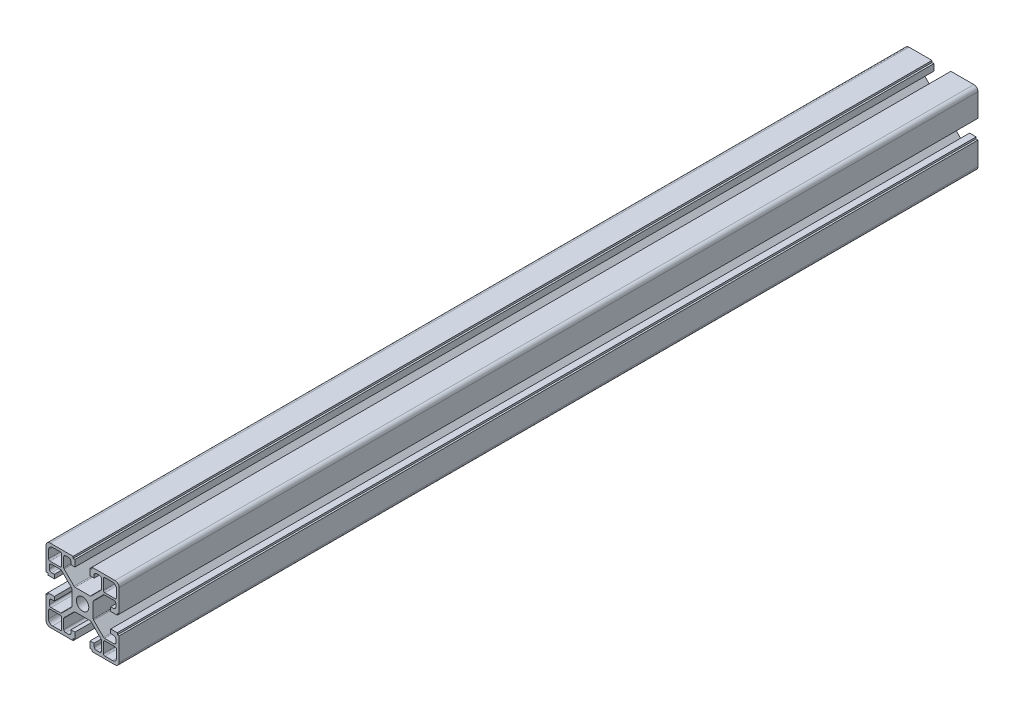
from build123d import *

# Parameters (mm, degrees)
SKETCH1_R           = 3.4
BOSS_EXTRUDE1_DEPTH = 713
SKETCH2_W           = 40
SKETCH2_H           = 243
CUT_EXTRUDE1_DEPTH  = 715.401147815


with BuildPart() as part:
    # Sketch1 → Boss-Extrude1 (new body)
    with BuildSketch(Plane.XY):
        with BuildLine():
            Line((20, 17.75), (20, 5.15))
            Line((20, 5.15), (19, 5.15))
            Line((19, 5.15), (19, 4.15))
            Line((19, 4.15), (15.4, 4.15))
            Line((15.4, 4.15), (15.4, 6.35))
            Line((15.4, 6.35), (16.95, 6.35))
            ThreePointArc((16.95, 6.35), (17.833883476, 6.716116524), (18.2, 7.6))
            Line((18.2, 7.6), (18.2, 9.3))
            ThreePointArc((18.2, 9.3), (17.907106781, 10.007106781), (17.2, 10.3))
            Line((17.2, 10.3), (12.03669957, 10.3))
            ThreePointArc((12.03669957, 10.3), (11.73040037, 10.239040459), (11.470780817, 10.065452001))
            Line((11.470780817, 10.065452001), (6.084081247, 4.674305984))
            ThreePointArc((6.084081247, 4.674305984), (5.910833239, 4.414848262), (5.85, 4.108853983))
            Line((5.85, 4.108853983), (5.85, -4.108853983))
            ThreePointArc((5.85, -4.108853983), (5.910833239, -4.414848262), (6.084081247, -4.674305984))
            Line((6.084081247, -4.674305984), (11.470780817, -10.065452001))
            ThreePointArc((11.470780817, -10.065452001), (11.73040037, -10.239040459), (12.03669957, -10.3))
            Line((12.03669957, -10.3), (17.2, -10.3))
            ThreePointArc((17.2, -10.3), (17.907106781, -10.007106781), (18.2, -9.3))
            Line((18.2, -9.3), (18.2, -7.6))
            ThreePointArc((18.2, -7.6), (17.833883476, -6.716116524), (16.95, -6.35))
            Line((16.95, -6.35), (15.4, -6.35))
            Line((15.4, -6.35), (15.4, -4.15))
            Line((15.4, -4.15), (19, -4.15))
            Line((19, -4.15), (19, -5.15))
            Line((19, -5.15), (20, -5.15))
            Line((20, -5.15), (20, -17.75))
            ThreePointArc((20, -17.75), (19.340990258, -19.340990258), (17.75, -20))
            Line((17.75, -20), (5.15, -20))
            Line((5.15, -20), (5.15, -19))
            Line((5.15, -19), (4.15, -19))
            Line((4.15, -19), (4.15, -15.4))
            Line((4.15, -15.4), (6.35, -15.4))
            Line((6.35, -15.4), (6.35, -16.95))
            ThreePointArc((6.35, -16.95), (6.716116524, -17.833883476), (7.6, -18.2))
            Line((7.6, -18.2), (9.3, -18.2))
            ThreePointArc((9.3, -18.2), (10.007106781, -17.907106781), (10.3, -17.2))
            Line((10.3, -17.2), (10.3, -12.054477022))
            ThreePointArc((10.3, -12.054477022), (10.239166761, -11.748482743), (10.065918753, -11.489025021))
            Line((10.065918753, -11.489025021), (4.665899173, -6.084547999))
            ThreePointArc((4.665899173, -6.084547999), (4.406279619, -5.910959541), (4.09998042, -5.85))
            Line((4.09998042, -5.85), (-4.09998042, -5.85))
            ThreePointArc((-4.09998042, -5.85), (-4.406279619, -5.910959541), (-4.665899173, -6.084547999))
            Line((-4.665899173, -6.084547999), (-10.065918753, -11.489025021))
            ThreePointArc((-10.065918753, -11.489025021), (-10.239166761, -11.748482743), (-10.3, -12.054477022))
            Line((-10.3, -12.054477022), (-10.3, -17.2))
            ThreePointArc((-10.3, -17.2), (-10.007106781, -17.907106781), (-9.3, -18.2))
            Line((-9.3, -18.2), (-7.6, -18.2))
            ThreePointArc((-7.6, -18.2), (-6.716116524, -17.833883476), (-6.35, -16.95))
            Line((-6.35, -16.95), (-6.35, -15.4))
            Line((-6.35, -15.4), (-4.15, -15.4))
            Line((-4.15, -15.4), (-4.15, -19))
            Line((-4.15, -19), (-5.15, -19))
            Line((-5.15, -19), (-5.15, -20))
            Line((-5.15, -20), (-17.75, -20))
            ThreePointArc((-17.75, -20), (-19.340990258, -19.340990258), (-20, -17.75))
            Line((-20, -17.75), (-20, -5.15))
            Line((-20, -5.15), (-19, -5.15))
            Line((-19, -5.15), (-19, -4.15))
            Line((-19, -4.15), (-15.4, -4.15))
            Line((-15.4, -4.15), (-15.4, -6.35))
            Line((-15.4, -6.35), (-16.95, -6.35))
            ThreePointArc((-16.95, -6.35), (-17.833883476, -6.716116524), (-18.2, -7.6))
            Line((-18.2, -7.6), (-18.2, -9.3))
            ThreePointArc((-18.2, -9.3), (-17.907106781, -10.007106781), (-17.2, -10.3))
            Line((-17.2, -10.3), (-12.03669957, -10.3))
            ThreePointArc((-12.03669957, -10.3), (-11.73040037, -10.239040459), (-11.470780817, -10.065452001))
            Line((-11.470780817, -10.065452001), (-6.084081247, -4.674305984))
            ThreePointArc((-6.084081247, -4.674305984), (-5.910833239, -4.414848262), (-5.85, -4.108853983))
            Line((-5.85, -4.108853983), (-5.85, 4.108853983))
            ThreePointArc((-5.85, 4.108853983), (-5.910833239, 4.414848262), (-6.084081247, 4.674305984))
            Line((-6.084081247, 4.674305984), (-11.470780817, 10.065452001))
            ThreePointArc((-11.470780817, 10.065452001), (-11.73040037, 10.239040459), (-12.03669957, 10.3))
            Line((-12.03669957, 10.3), (-17.2, 10.3))
            ThreePointArc((-17.2, 10.3), (-17.907106781, 10.007106781), (-18.2, 9.3))
            Line((-18.2, 9.3), (-18.2, 7.6))
            ThreePointArc((-18.2, 7.6), (-17.833883476, 6.716116524), (-16.95, 6.35))
            Line((-16.95, 6.35), (-15.4, 6.35))
            Line((-15.4, 6.35), (-15.4, 4.15))
            Line((-15.4, 4.15), (-19, 4.15))
            Line((-19, 4.15), (-19, 5.15))
            Line((-19, 5.15), (-20, 5.15))
            Line((-20, 5.15), (-20, 17.75))
            ThreePointArc((-20, 17.75), (-19.340990258, 19.340990258), (-17.75, 20))
            Line((-17.75, 20), (-5.15, 20))
            Line((-5.15, 20), (-5.15, 19))
            Line((-5.15, 19), (-4.15, 19))
            Line((-4.15, 19), (-4.15, 15.4))
            Line((-4.15, 15.4), (-6.35, 15.4))
            Line((-6.35, 15.4), (-6.35, 16.95))
            ThreePointArc((-6.35, 16.95), (-6.716116524, 17.833883476), (-7.6, 18.2))
            Line((-7.6, 18.2), (-9.3, 18.2))
            ThreePointArc((-9.3, 18.2), (-10.007106781, 17.907106781), (-10.3, 17.2))
            Line((-10.3, 17.2), (-10.3, 12.054477022))
            ThreePointArc((-10.3, 12.054477022), (-10.239166761, 11.748482743), (-10.065918753, 11.489025021))
            Line((-10.065918753, 11.489025021), (-4.665899173, 6.084547999))
            ThreePointArc((-4.665899173, 6.084547999), (-4.406279619, 5.910959541), (-4.09998042, 5.85))
            Line((-4.09998042, 5.85), (4.09998042, 5.85))
            ThreePointArc((4.09998042, 5.85), (4.406279619, 5.910959541), (4.665899173, 6.084547999))
            Line((4.665899173, 6.084547999), (10.065918753, 11.489025021))
            ThreePointArc((10.065918753, 11.489025021), (10.239166761, 11.748482743), (10.3, 12.054477022))
            Line((10.3, 12.054477022), (10.3, 17.2))
            ThreePointArc((10.3, 17.2), (10.007106781, 17.907106781), (9.3, 18.2))
            Line((9.3, 18.2), (7.6, 18.2))
            ThreePointArc((7.6, 18.2), (6.716116524, 17.833883476), (6.35, 16.95))
            Line((6.35, 16.95), (6.35, 15.4))
            Line((6.35, 15.4), (4.15, 15.4))
            Line((4.15, 15.4), (4.15, 19))
            Line((4.15, 19), (5.15, 19))
            Line((5.15, 19), (5.15, 20))
            Line((5.15, 20), (17.75, 20))
            ThreePointArc((17.75, 20), (19.340990258, 19.340990258), (20, 17.75))
        make_face()
        with Locations(Location((0, 0, 0), (0, 0, 180))):
            Circle(SKETCH1_R, mode=Mode.SUBTRACT)
        with BuildLine():
            Line((18.6, 16.35), (18.6, 12.2))
            ThreePointArc((18.6, 12.2), (18.365685425, 11.634314575), (17.8, 11.4))
            Line((17.8, 11.4), (12.2, 11.4))
            ThreePointArc((12.2, 11.4), (11.634314575, 11.634314575), (11.4, 12.2))
            Line((11.4, 12.2), (11.4, 17.8))
            ThreePointArc((11.4, 17.8), (11.634314575, 18.365685425), (12.2, 18.6))
            Line((12.2, 18.6), (16.35, 18.6))
            ThreePointArc((16.35, 18.6), (17.940990258, 17.940990258), (18.6, 16.35))
        make_face(mode=Mode.SUBTRACT)
        with BuildLine():
            Line((-12.2, 18.6), (-16.35, 18.6))
            ThreePointArc((-16.35, 18.6), (-17.940990258, 17.940990258), (-18.6, 16.35))
            Line((-18.6, 16.35), (-18.6, 12.2))
            ThreePointArc((-18.6, 12.2), (-18.365685425, 11.634314575), (-17.8, 11.4))
            Line((-17.8, 11.4), (-12.2, 11.4))
            ThreePointArc((-12.2, 11.4), (-11.634314575, 11.634314575), (-11.4, 12.2))
            Line((-11.4, 12.2), (-11.4, 17.8))
            ThreePointArc((-11.4, 17.8), (-11.634314575, 18.365685425), (-12.2, 18.6))
        make_face(mode=Mode.SUBTRACT)
        with BuildLine():
            Line((-18.6, -16.35), (-18.6, -12.2))
            ThreePointArc((-18.6, -12.2), (-18.365685425, -11.634314575), (-17.8, -11.4))
            Line((-17.8, -11.4), (-12.2, -11.4))
            ThreePointArc((-12.2, -11.4), (-11.634314575, -11.634314575), (-11.4, -12.2))
            Line((-11.4, -12.2), (-11.4, -17.8))
            ThreePointArc((-11.4, -17.8), (-11.634314575, -18.365685425), (-12.2, -18.6))
            Line((-12.2, -18.6), (-16.35, -18.6))
            ThreePointArc((-16.35, -18.6), (-17.940990258, -17.940990258), (-18.6, -16.35))
        make_face(mode=Mode.SUBTRACT)
        with BuildLine():
            Line((12.2, -18.6), (16.35, -18.6))
            ThreePointArc((16.35, -18.6), (17.940990258, -17.940990258), (18.6, -16.35))
            Line((18.6, -16.35), (18.6, -12.2))
            ThreePointArc((18.6, -12.2), (18.365685425, -11.634314575), (17.8, -11.4))
            Line((17.8, -11.4), (12.2, -11.4))
            ThreePointArc((12.2, -11.4), (11.634314575, -11.634314575), (11.4, -12.2))
            Line((11.4, -12.2), (11.4, -17.8))
            ThreePointArc((11.4, -17.8), (11.634314575, -18.365685425), (12.2, -18.6))
        make_face(mode=Mode.SUBTRACT)
    extrude(amount=BOSS_EXTRUDE1_DEPTH)

    # Sketch2 → Cut-Extrude1 (cut, through all)
    with BuildSketch(Plane(origin=(0, 20, 0), x_dir=(1, 0, 0), z_dir=(0, 1, 0))):
        with Locations((0, -591.5)):
            Rectangle(SKETCH2_W, SKETCH2_H)
    extrude(amount=-CUT_EXTRUDE1_DEPTH, mode=Mode.SUBTRACT)


solid = part.part
